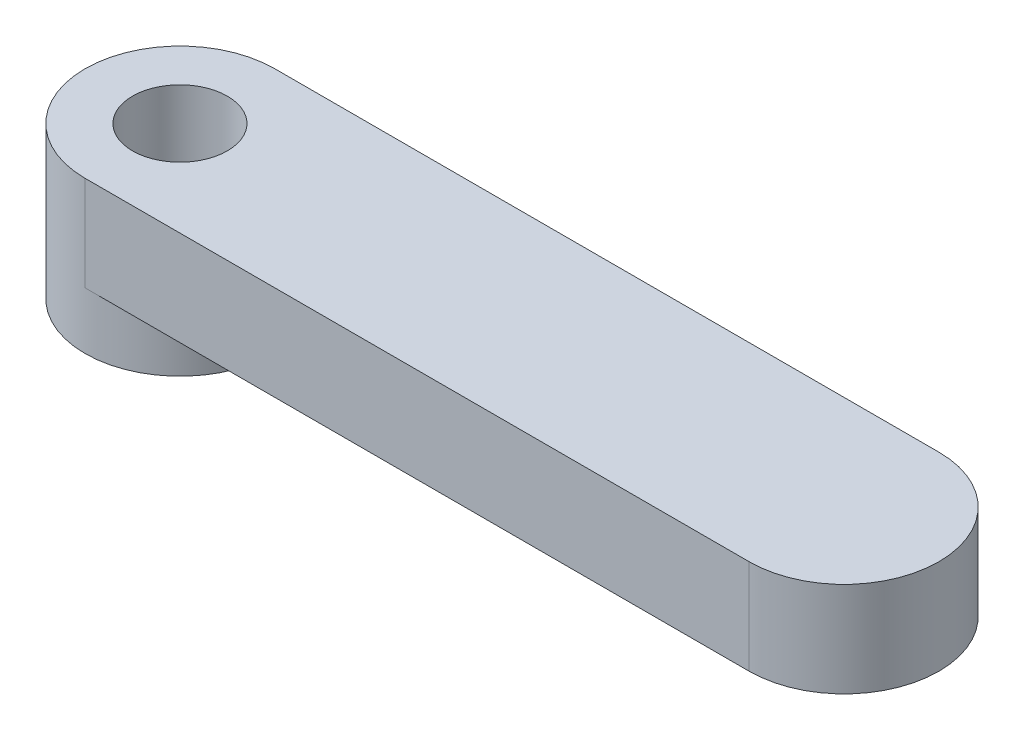
from build123d import *

# Parameters (mm, degrees)
SKETCH_1_R      = 2.5
EXTRUDE_1_DEPTH = 5
EXTRUDE_START   = 3
SKETCH_2_R      = 5
SKETCH_2_R_2    = 2.5
EXTRUDE_2_DEPTH = 3


with BuildPart() as part:
    # 草图1 → 凸台-拉伸1 (new body)
    with BuildSketch(Plane(origin=(0, 0, 0), x_dir=(1, 0, 0), z_dir=(0, 1, 0))):
        with BuildLine():
            Line((-34.30294509, -6.015613436), (0.69705491, -6.015613436))
            ThreePointArc((0.69705491, -6.015613436), (5.69705491, -11.015613436), (0.69705491, -16.015613436))
            Line((0.69705491, -16.015613436), (-34.30294509, -16.015613436))
            ThreePointArc((-34.30294509, -16.015613436), (-39.30294509, -11.015613436), (-34.30294509, -6.015613436))
        make_face()
        with Locations(Location((-34.30294509, -11.015613436, 0), (0, 0, 270))):
            Circle(SKETCH_1_R, mode=Mode.SUBTRACT)
    extrude(amount=EXTRUDE_1_DEPTH)

    # 草图2 → 凸台-拉伸2 (add)
    with BuildSketch(Plane.XZ.offset(EXTRUDE_START)):
        with Locations(Location((-34.30294509, 11.015613436, 0), (0, 0, 270))):
            Circle(SKETCH_2_R)
        with Locations(Location((-34.30294509, 11.015613436, 0), (0, 0, 270))):
            Circle(SKETCH_2_R_2, mode=Mode.SUBTRACT)
    extrude(amount=-EXTRUDE_2_DEPTH)


solid = part.part
